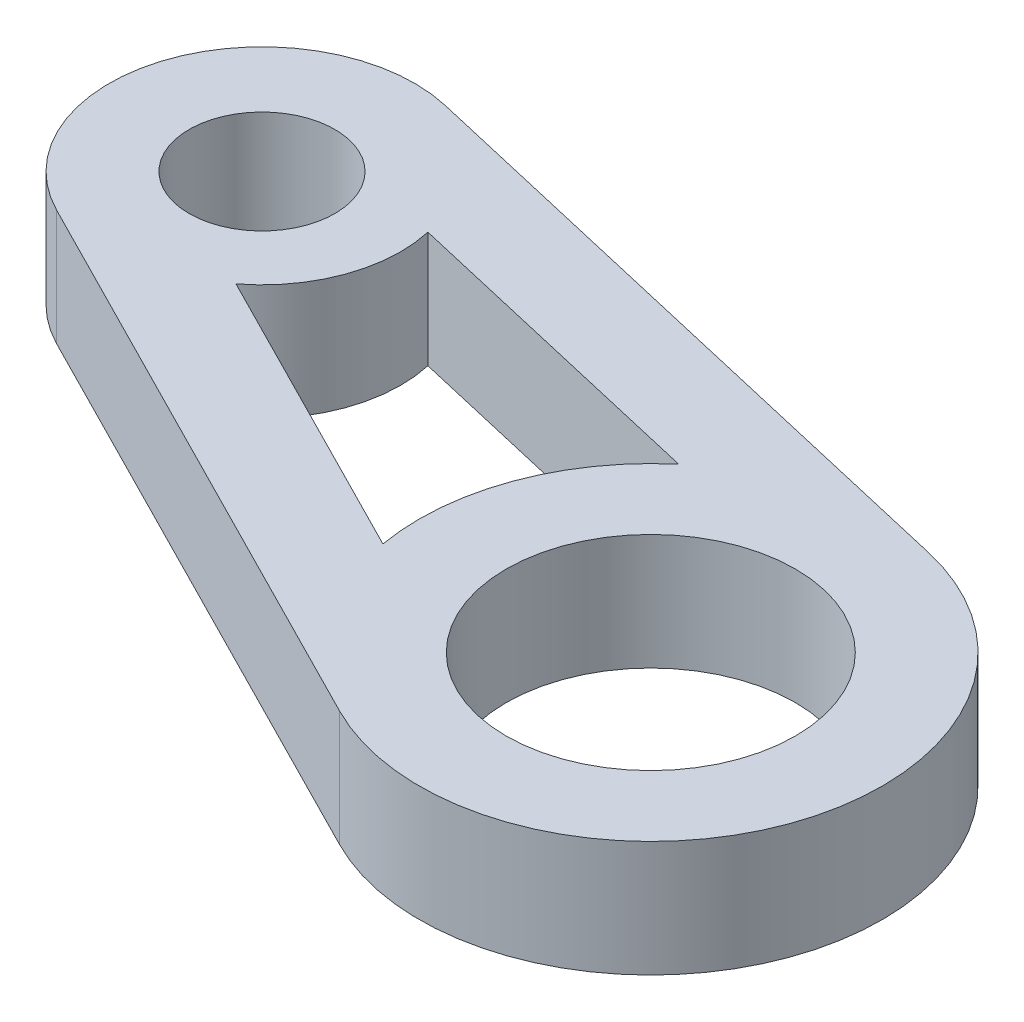
from build123d import *

# Parameters (mm, degrees)
SKETCH1_R           = 2
SKETCH1_R_2         = 3.96875
BOSS_EXTRUDE1_DEPTH = 3.175


with BuildPart() as part:
    # Sketch1 → Boss-Extrude1 (new body)
    with BuildSketch(Plane(origin=(0, 0, 0), x_dir=(1, 0, 0), z_dir=(0, 1, 0))):
        with BuildLine():
            Line((18.195821705, 0.090468023), (0.945002326, 4.083068895))
            ThreePointArc((0.945002326, 4.083068895), (-3.938674238, 1.432245177), (-1.898429333, -3.736368165))
            Line((-1.898429333, -3.736368165), (13.88759192, -11.757163887))
            ThreePointArc((13.88759192, -11.757163887), (22.731688239, -8.266068451), (18.195821705, 0.090468023))
        make_face()
        with Locations(Location((0, 0, 0), (0, 0, 270))):
            Circle(SKETCH1_R, mode=Mode.SUBTRACT)
        with Locations(Location((16.764, -6.096, 0), (0, 0, 270))):
            Circle(SKETCH1_R_2, mode=Mode.SUBTRACT)
        with BuildLine():
            Line((10.509224042, -7.191571868), (2.313352981, -3.027292187))
            ThreePointArc((2.313352981, -3.027292187), (3.580612943, -1.30204107), (3.717545806, 0.834238083))
            Line((3.717545806, 0.834238083), (12.673918605, -1.238661822))
            ThreePointArc((12.673918605, -1.238661822), (10.796311761, -3.925931549), (10.509224042, -7.191571868))
        make_face(mode=Mode.SUBTRACT)
    extrude(amount=BOSS_EXTRUDE1_DEPTH)


solid = part.part
